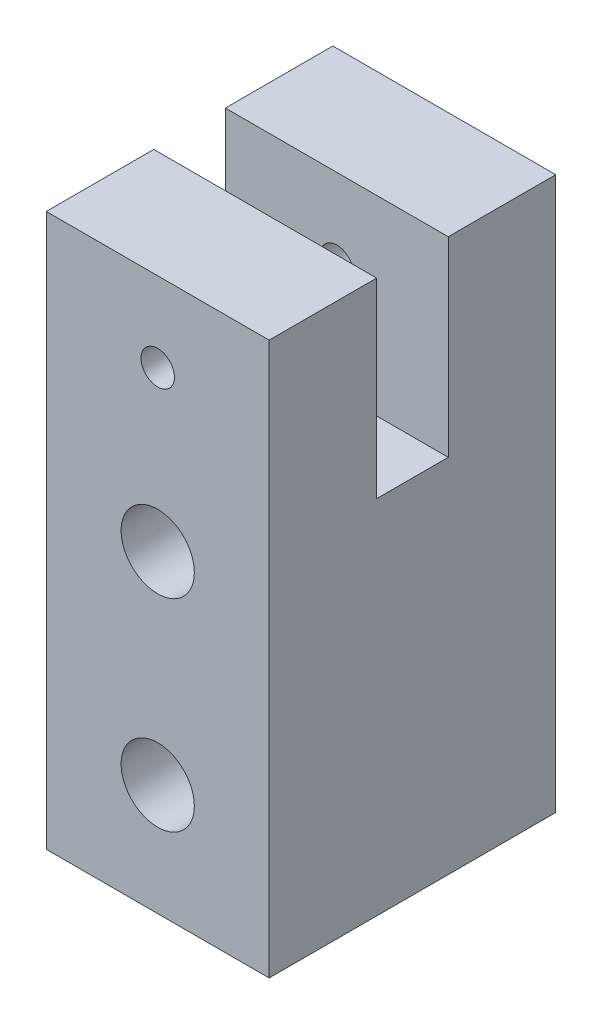
from build123d import *

# Parameters (mm, degrees)
SKETCH2_W           = 14
SKETCH2_H           = 34.7
BOSS_EXTRUDE1_DEPTH = 18
SKETCH3_R           = 2.3
CUT_EXTRUDE1_DEPTH  = 26.961943302
SKETCH4_W           = 4.5
SKETCH4_H           = 12
CUT_EXTRUDE2_DEPTH  = 8
SKETCH5_R           = 1.05
CUT_EXTRUDE3_DEPTH  = 26.961943302
SKETCH8_W           = 4.5
SKETCH8_H           = 7
CUT_EXTRUDE6_DEPTH  = 29.653490189


with BuildPart() as part:
    # Sketch2 → Boss-Extrude1 (new body)
    with BuildSketch(Plane.XY):
        Rectangle(SKETCH2_W, SKETCH2_H)
    extrude(amount=BOSS_EXTRUDE1_DEPTH)

    # Sketch3 → Cut-Extrude1 (cut, through all)
    with BuildSketch(Plane.XY.offset(18)):
        with Locations((0, -10.35)):
            Circle(SKETCH3_R)
        with Locations((0, 2.35)):
            Circle(SKETCH3_R)
    extrude(amount=-CUT_EXTRUDE1_DEPTH, mode=Mode.SUBTRACT)

    # Sketch4 → Cut-Extrude2 (cut)
    with BuildSketch(Plane(origin=(7, 0, 0), x_dir=(0, 0, -1), z_dir=(1, 0, 0))):
        with Locations((-9, 11.35)):
            Rectangle(SKETCH4_W, SKETCH4_H)
    extrude(amount=-CUT_EXTRUDE2_DEPTH, mode=Mode.SUBTRACT)

    # Sketch5 → Cut-Extrude3 (cut, through all)
    with BuildSketch(Plane.XY.offset(18)):
        with Locations((0, 12.35)):
            Circle(SKETCH5_R)
    extrude(amount=-CUT_EXTRUDE3_DEPTH, mode=Mode.SUBTRACT)

    # Sketch8 → Cut-Extrude6 (cut, through all)
    with BuildSketch(Plane(origin=(7, 0, 0), x_dir=(0, 0, -1), z_dir=(1, 0, 0))):
        with Locations((-9, 13.85)):
            Rectangle(SKETCH8_W, SKETCH8_H)
    extrude(amount=-CUT_EXTRUDE6_DEPTH, mode=Mode.SUBTRACT)


solid = part.part
